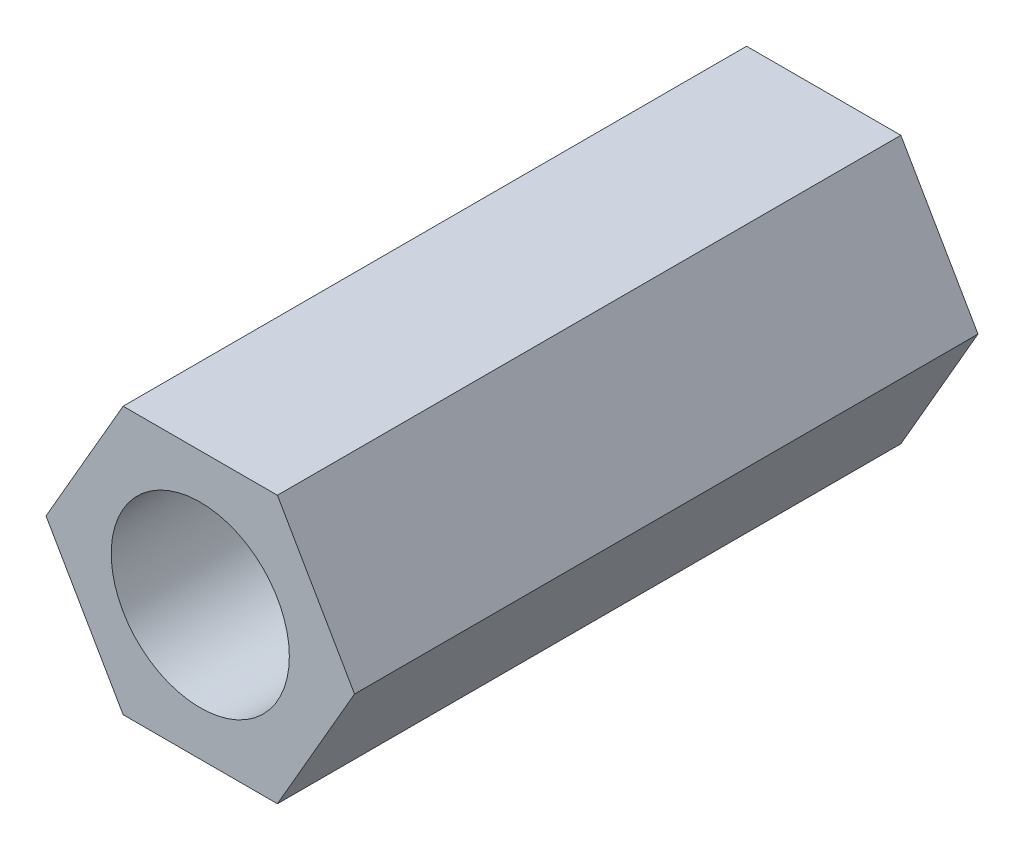
from build123d import *

# Parameters (mm, degrees)
SKETCH_1_R      = 1
EXTRUDE_1_DEPTH = 7


with BuildPart() as part:
    # 草图1 → 凸台-拉伸1 (new body)
    with BuildSketch(Plane.XY):
        Polygon((1.732050808, 0), (0.866025404, 1.5), (-0.866025404, 1.5), (-1.732050808, 0), (-0.866025404, -1.5), (0.866025404, -1.5), align=None)
        Circle(SKETCH_1_R, mode=Mode.SUBTRACT)
    extrude(amount=EXTRUDE_1_DEPTH)


solid = part.part
